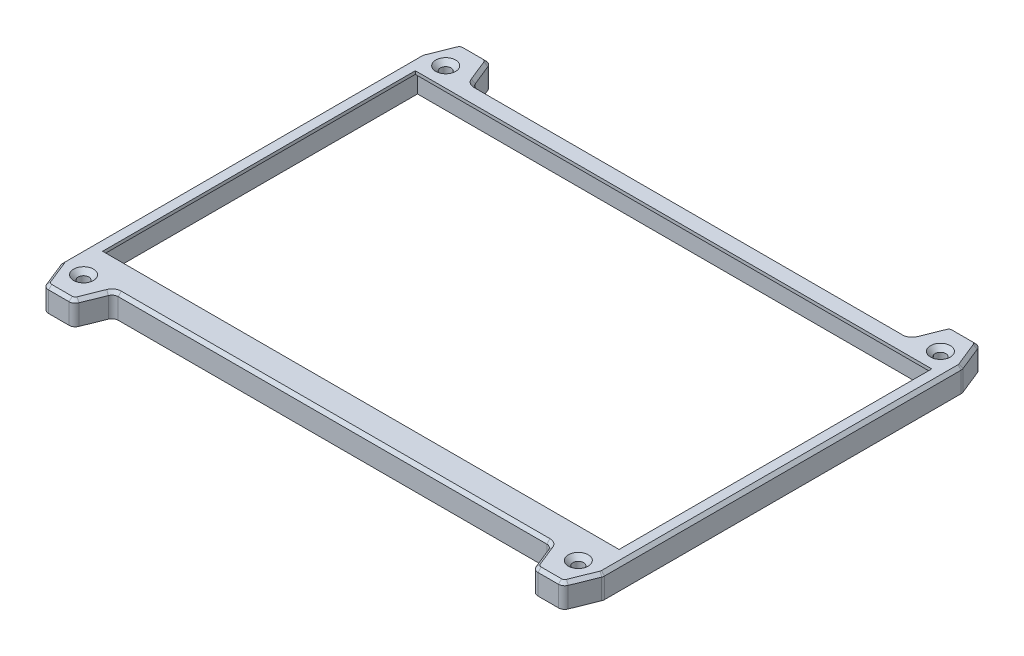
from build123d import *

# Parameters (mm, degrees)
SKETCH1_W                                      = 172
SKETCH1_H                                      = 114
BOSS_EXTRUDE1_DEPTH                            = 7.5
SKETCH2_W                                      = 164
SKETCH2_H                                      = 100
CUT_EXTRUDE1_DEPTH                             = 109.787361398
SKETCH8_W                                      = 165.5
SKETCH8_H                                      = 101.5
CUT_EXTRUDE3_DEPTH                             = 6.5
CSK_FOR_M3_FLAT_HEAD_MACHINE_SCREW1_AT_2_COUNT = 2
CSK_FOR_M3_FLAT_HEAD_MACHINE_SCREW1_AT_2_PITCH = 157.1
CSK_FOR_M3_FLAT_HEAD_MACHINE_SCREW1_AT_3_COUNT = 2
CSK_FOR_M3_FLAT_HEAD_MACHINE_SCREW1_AT_3_PITCH = 194.693117495
CSK_FOR_M3_FLAT_HEAD_MACHINE_SCREW1_AT_4_COUNT = 2
CSK_FOR_M3_FLAT_HEAD_MACHINE_SCREW1_AT_4_PITCH = 115
CSK_FOR_M3_FLAT_HEAD_MACHINE_SCREW1_AT_5_COUNT = 2
CSK_FOR_M3_FLAT_HEAD_MACHINE_SCREW1_AT_5_PITCH = 97.346558748
BOSS_EXTRUDE2_START                            = -2
SKETCH6_W                                      = 16.25
SKETCH6_H                                      = 2
BOSS_EXTRUDE2_DEPTH                            = 1.2
SKETCH6_W_2                                    = 8
BOSS_EXTRUDE2_2_DEPTH                          = 1.2
BOSS_EXTRUDE2_3_DEPTH                          = 1.2
SKETCH7_W                                      = 30
SKETCH7_H                                      = 5
CUT_EXTRUDE2_DEPTH                             = 7
SKETCH9_W                                      = 164
SKETCH9_H                                      = 1
BOSS_EXTRUDE3_DEPTH                            = 0.7
FILLET1_R                                      = 2
CHAMFER1_SIZE                                  = 1


with BuildPart() as part:
    # Sketch1 → Boss-Extrude1 (new body)
    with BuildSketch(Plane(origin=(0, 0, 0), x_dir=(1, 0, 0), z_dir=(0, 1, 0))):
        Polygon((-69.4, -57), (-86, -57), (-82.3, -66.2), (-73.1, -66.2), align=None)
        Rectangle(SKETCH1_W, SKETCH1_H)
        Polygon((86, -57), (69.4, -57), (73.1, -66.2), (82.3, -66.2), align=None)
        Polygon((73.1, 66.2), (69.4, 57), (86, 57), (82.3, 66.2), align=None)
        Polygon((-82.3, 66.2), (-86, 57), (-69.4, 57), (-73.1, 66.2), align=None)
    extrude(amount=BOSS_EXTRUDE1_DEPTH)

    # Sketch2 → Cut-Extrude1 (cut, through all)
    with BuildSketch(Plane(origin=(0, 7.5, 0), x_dir=(1, 0, 0), z_dir=(0, 1, 0))):
        with Locations((0, 2)):
            Rectangle(SKETCH2_W, SKETCH2_H)
    extrude(amount=-CUT_EXTRUDE1_DEPTH, mode=Mode.SUBTRACT)

    # Sketch8 → Cut-Extrude3 (cut)
    with BuildSketch(Plane.XZ):
        with Locations((0, -2)):
            Rectangle(SKETCH8_W, SKETCH8_H)
    extrude(amount=-CUT_EXTRUDE3_DEPTH, mode=Mode.SUBTRACT)

    # Sketch4 → CSK for M3 Flat Head Machine Screw1 (revolve, cut)
    with BuildSketch(Plane(origin=(-78.55, 7.5, -57.5), x_dir=(0, 0, 1), z_dir=(1, 0, 0))):
        Polygon((0, 0), (0, 7.5), (2.2, 7.5), (1.7, 7), (1.7, 1.45), (3.15, 0), align=None)
    csk_for_m3_flat_head_machine_screw1 = revolve(axis=Axis((-78.55, 13.85, -57.5), (0, -1, 0)), mode=Mode.SUBTRACT)

    # CSK for M3 Flat Head Machine Screw1 at 2: CSK for M3 Flat Head Machine Screw1 ×2
    with Locations(*[(i * CSK_FOR_M3_FLAT_HEAD_MACHINE_SCREW1_AT_2_PITCH, 0, 0) for i in range(1, CSK_FOR_M3_FLAT_HEAD_MACHINE_SCREW1_AT_2_COUNT)]):
        add(csk_for_m3_flat_head_machine_screw1, mode=Mode.SUBTRACT)

    # CSK for M3 Flat Head Machine Screw1 at 3: CSK for M3 Flat Head Machine Screw1 ×2
    with Locations(*[Vector(0.8069109068730828, 0, 0.5906731654386028) * (i * CSK_FOR_M3_FLAT_HEAD_MACHINE_SCREW1_AT_3_PITCH) for i in range(1, CSK_FOR_M3_FLAT_HEAD_MACHINE_SCREW1_AT_3_COUNT)]):
        add(csk_for_m3_flat_head_machine_screw1, mode=Mode.SUBTRACT)

    # CSK for M3 Flat Head Machine Screw1 at 4: CSK for M3 Flat Head Machine Screw1 ×2
    with Locations(*[(0, 0, i * CSK_FOR_M3_FLAT_HEAD_MACHINE_SCREW1_AT_4_PITCH) for i in range(1, CSK_FOR_M3_FLAT_HEAD_MACHINE_SCREW1_AT_4_COUNT)]):
        add(csk_for_m3_flat_head_machine_screw1, mode=Mode.SUBTRACT)

    # CSK for M3 Flat Head Machine Screw1 at 5: CSK for M3 Flat Head Machine Screw1 ×2
    with Locations(*[Vector(0.8069109068730828, 0, 0.5906731654386028) * (i * CSK_FOR_M3_FLAT_HEAD_MACHINE_SCREW1_AT_5_PITCH) for i in range(1, CSK_FOR_M3_FLAT_HEAD_MACHINE_SCREW1_AT_5_COUNT)]):
        add(csk_for_m3_flat_head_machine_screw1, mode=Mode.SUBTRACT)

    # Sketch7 → Cut-Extrude2 (cut)
    with BuildSketch(Plane.XZ):
        with Locations((67, 50.5)):
            Rectangle(SKETCH7_W, SKETCH7_H)
    extrude(amount=-CUT_EXTRUDE2_DEPTH, mode=Mode.SUBTRACT)

    # Sketch9 → Boss-Extrude3 (add)
    with BuildSketch(Plane.XY.offset(-52)):
        with Locations((0, 7)):
            Rectangle(SKETCH9_W, SKETCH9_H)
    extrude(amount=BOSS_EXTRUDE3_DEPTH)

    # Fillet1
    fillet1_edges = [part.edges().sort_by_distance(p)[0] for p in [
        (-86, 3.75, 57),
        (-73.1, 3.75, -66.2),
        (-69.4, 3.75, -57),
        (69.4, 3.75, -57),
        (73.1, 3.75, -66.2),
        (82.3, 3.75, -66.2),
        (86, 3.75, -57),
        (86, 3.75, 57),
        (82.3, 3.75, 66.2),
        (73.1, 3.75, 66.2),
        (69.4, 3.75, 57),
        (-69.4, 3.75, 57),
        (-73.1, 3.75, 66.2),
        (-82.3, 3.75, 66.2),
        (-86, 3.75, -57),
        (-82.3, 3.75, -66.2),
        (52, 6.75, 48),
    ]]
    fillet(fillet1_edges, radius=FILLET1_R)

    # Chamfer1
    chamfer1_edges = [part.edges().sort_by_distance(p)[0] for p in [
        (67, 7, 53),
        (-84.329890843, 7.5, 61.152703851),
        (-86, 7.5, 0),
        (-77.7, 7.5, 66.2),
        (-71.25, 7.5, 61.6),
        (0, 7.5, 57),
        (71.25, 7.5, 61.6),
        (77.7, 7.5, 66.2),
        (84.329890843, 7.5, 61.152703851),
        (86, 7.5, 0),
        (84.329890843, 7.5, -61.152703851),
        (77.7, 7.5, -66.2),
        (71.25, 7.5, -61.6),
        (0, 7.5, -57),
        (-71.25, 7.5, -61.6),
        (-77.7, 7.5, -66.2),
        (-84.329890843, 7.5, -61.152703851),
        (-82.068369823, 7.5, -65.8571836),
        (-85.963557779, 7.5, -56.992946476),
        (-82.068369823, 7.5, 65.8571836),
        (-73.331630177, 7.5, 65.8571836),
        (73.331630177, 7.5, 65.8571836),
        (82.068369823, 7.5, 65.8571836),
        (85.963557779, 7.5, 56.992946476),
        (85.963557779, 7.5, -56.992946476),
        (82.068369823, 7.5, -65.8571836),
        (73.331630177, 7.5, -65.8571836),
        (-73.331630177, 7.5, -65.8571836),
        (-85.963557779, 7.5, 56.992946476),
        (-69.168369823, 7.5, -57.3428164),
        (69.168369823, 7.5, -57.3428164),
        (69.168369823, 7.5, 57.3428164),
        (-69.168369823, 7.5, 57.3428164),
    ]]
    chamfer(chamfer1_edges, length=CHAMFER1_SIZE)


with BuildPart() as body_2:
    # Sketch6 → Boss-Extrude2 (new body)
    with BuildSketch(Plane(origin=(86, 0, 0), x_dir=(0, 0, -1), z_dir=(1, 0, 0)).offset(BOSS_EXTRUDE2_START)):
        with Locations((42.825, -1)):
            Rectangle(SKETCH6_W, SKETCH6_H)
    extrude(amount=-BOSS_EXTRUDE2_DEPTH)


with BuildPart() as body_3:
    # Sketch6 → Boss-Extrude2 2 (new body)
    with BuildSketch(Plane(origin=(86, 0, 0), x_dir=(0, 0, -1), z_dir=(1, 0, 0)).offset(BOSS_EXTRUDE2_START)):
        with Locations((22.95, -1)):
            Rectangle(SKETCH6_W_2, SKETCH6_H)
    extrude(amount=-BOSS_EXTRUDE2_2_DEPTH)


with BuildPart() as body_4:
    # Sketch6 → Boss-Extrude2 3 (new body)
    with BuildSketch(Plane(origin=(86, 0, 0), x_dir=(0, 0, -1), z_dir=(1, 0, 0)).offset(BOSS_EXTRUDE2_START)):
        with Locations((8.7, -1)):
            Rectangle(SKETCH6_W_2, SKETCH6_H)
    extrude(amount=-BOSS_EXTRUDE2_3_DEPTH)


solid = Compound([part.part, body_2.part, body_3.part, body_4.part])
